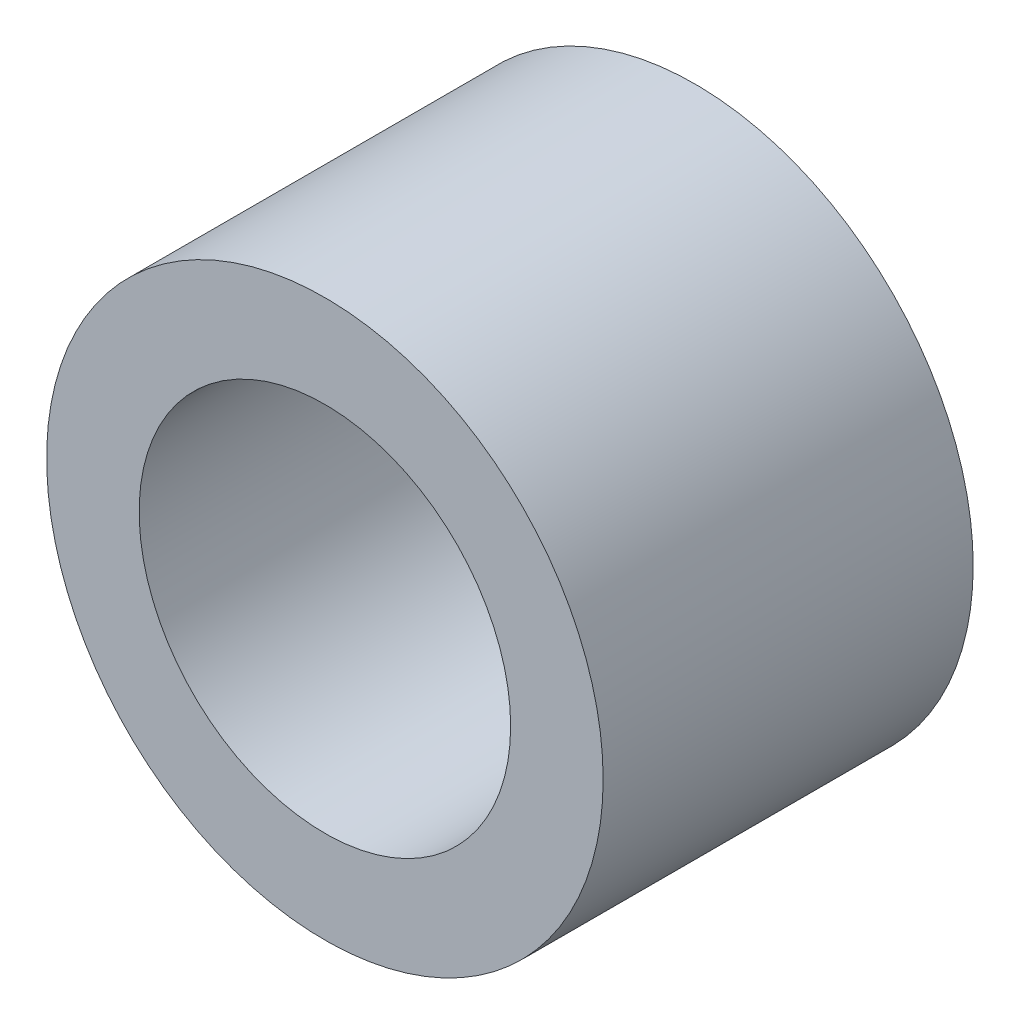
from build123d import *

# Parameters (mm, degrees)
SKETCH1_R      = 4.7752
SKETCH1_R_2    = 3.1877
EXTRUDE1_DEPTH = 3.175


with BuildPart() as part:
    # Sketch1 → Extrude1 (new, symmetric)
    with BuildSketch(Plane.XY):
        Circle(SKETCH1_R)
        Circle(SKETCH1_R_2, mode=Mode.SUBTRACT)
    extrude(amount=EXTRUDE1_DEPTH, both=True)


solid = part.part
